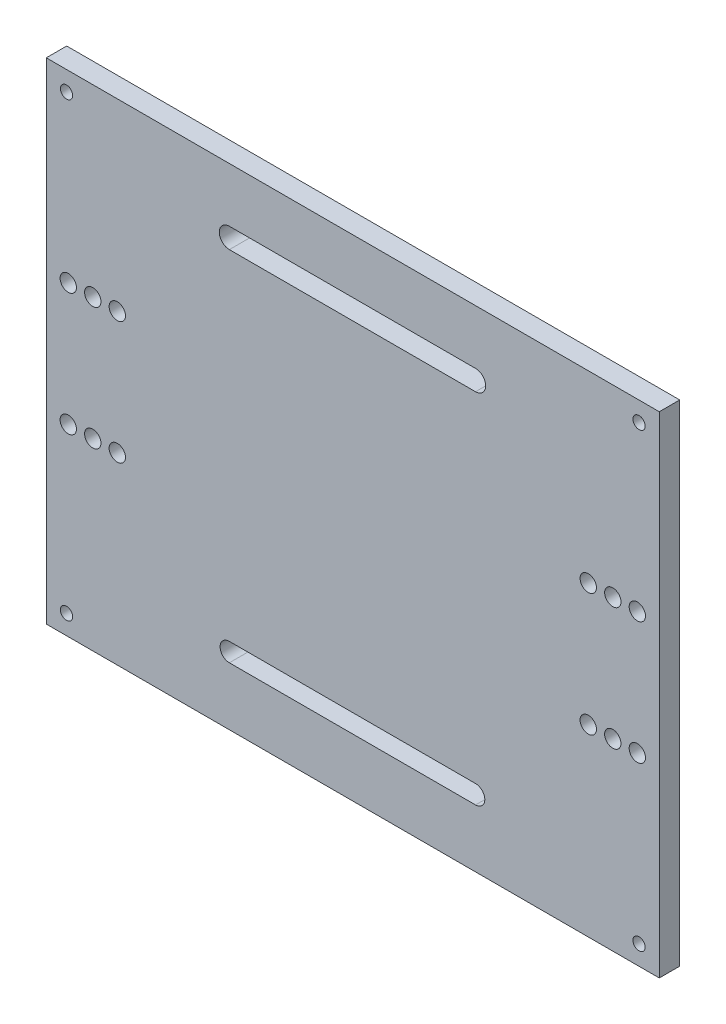
from build123d import *

# Parameters (mm, degrees)
MODEL_W             = 150
MODEL_H             = 120
MODEL_R             = 2
MODEL_R_2           = 1.5
BOSS_EXTRUDE1_DEPTH = 5
CUT_EXTRUDE1_DEPTH  = 216.636798312


with BuildPart() as part:
    # Model → Boss-Extrude1 (new body)
    with BuildSketch(Plane.XY):
        with Locations((90.051044639, 78.680861873)):
            Rectangle(MODEL_W, MODEL_H)
        with Locations((20.427424183, 93.680861873)):
            Circle(MODEL_R, mode=Mode.SUBTRACT)
        with Locations((26.427424183, 93.680861873)):
            Circle(MODEL_R, mode=Mode.SUBTRACT)
        with Locations((32.427424183, 93.680861873)):
            Circle(MODEL_R, mode=Mode.SUBTRACT)
        with Locations((20.427424183, 63.680861873)):
            Circle(MODEL_R, mode=Mode.SUBTRACT)
        with Locations((26.427424183, 63.680861873)):
            Circle(MODEL_R, mode=Mode.SUBTRACT)
        with Locations((32.427424183, 63.680861873)):
            Circle(MODEL_R, mode=Mode.SUBTRACT)
        with Locations((159.674665094, 93.680861873)):
            Circle(MODEL_R, mode=Mode.SUBTRACT)
        with Locations((153.674665094, 93.680861873)):
            Circle(MODEL_R, mode=Mode.SUBTRACT)
        with Locations((147.674665094, 93.680861873)):
            Circle(MODEL_R, mode=Mode.SUBTRACT)
        with Locations((159.674665094, 63.680861873)):
            Circle(MODEL_R, mode=Mode.SUBTRACT)
        with Locations((153.674665094, 63.680861873)):
            Circle(MODEL_R, mode=Mode.SUBTRACT)
        with Locations((147.674665094, 63.680861873)):
            Circle(MODEL_R, mode=Mode.SUBTRACT)
        with Locations((20.005670629, 133.907298569)):
            Circle(MODEL_R_2, mode=Mode.SUBTRACT)
        with Locations((160.096418648, 133.907298569)):
            Circle(MODEL_R_2, mode=Mode.SUBTRACT)
        with Locations((20.005670629, 23.454425177)):
            Circle(MODEL_R_2, mode=Mode.SUBTRACT)
        with Locations((160.096418648, 23.454425177)):
            Circle(MODEL_R_2, mode=Mode.SUBTRACT)
    extrude(amount=BOSS_EXTRUDE1_DEPTH)

    # Sketch3 → Cut-Extrude1 (cut, through all)
    with BuildSketch(Plane.XY.offset(5)):
        with BuildLine():
            Line((59.848510467, 125.37915187), (120.08763082, 125.37915187))
            ThreePointArc((120.08763082, 125.37915187), (122.560781495, 122.906001195), (120.08763082, 120.43285052))
            Line((120.08763082, 120.43285052), (59.848510467, 120.43285052))
            ThreePointArc((59.848510467, 120.43285052), (57.375359792, 122.906001195), (59.848510467, 125.37915187))
        make_face()
        with BuildLine():
            Line((59.848510467, 37.411582635), (120.08763082, 37.411582635))
            ThreePointArc((120.08763082, 37.411582635), (122.355268775, 35.14394468), (120.08763082, 32.876306725))
            Line((120.08763082, 32.876306725), (59.848510467, 32.876306725))
            ThreePointArc((59.848510467, 32.876306725), (57.580872512, 35.14394468), (59.848510467, 37.411582635))
        make_face()
    extrude(amount=-CUT_EXTRUDE1_DEPTH, mode=Mode.SUBTRACT)


solid = part.part
